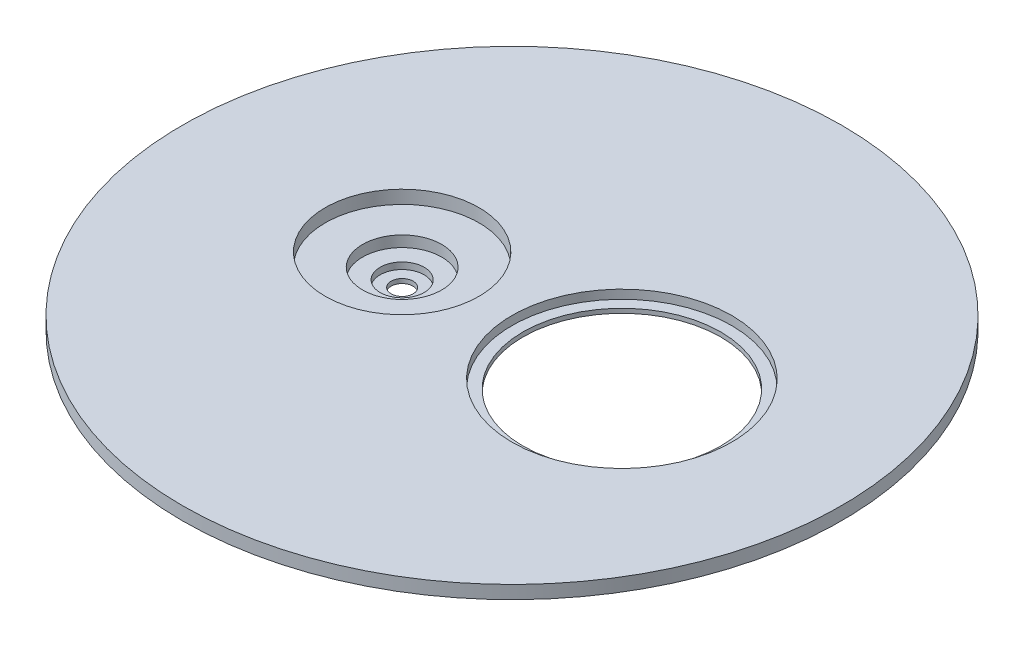
from build123d import *

# Parameters (mm, degrees)
SKETCH_1_R          = 75
EXTRUDE_1_DEPTH     = 3
SKETCH_2_R          = 17.5
SKETCH_2_R_2        = 25
CUT_EXTRUDE_1_DEPTH = 2
SKETCH_3_R          = 22.5
CUT_EXTRUDE_2_DEPTH = 2
SKETCH_12_R         = 17.5
CUT_EXTRUDE_7_DEPTH = 1
SKETCH_15_R         = 18.5
SKETCH_15_R_2       = 9
EXTRUDE_6_DEPTH     = 2.5
SKETCH_16_R         = 10
SKETCH_16_R_2       = 2.5
EXTRUDE_7_DEPTH     = 2.5
SKETCH_17_R         = 5
CUT_EXTRUDE_9_DEPTH = 1.5


with BuildPart() as part:
    # 草图1 → 凸台-拉伸1 (new body)
    with BuildSketch(Plane(origin=(0, 0, 0), x_dir=(1, 0, 0), z_dir=(0, 1, 0))):
        with Locations(Location((0, 0, 0), (0, 0, 270))):
            Circle(SKETCH_1_R)
    extrude(amount=EXTRUDE_1_DEPTH)

    # 草图2 → 切除-拉伸1 (cut)
    with BuildSketch(Plane(origin=(0, 3, 0), x_dir=(1, 0, 0), z_dir=(0, 1, 0))):
        with Locations(Location((-25, 0, 0), (0, 0, 270))):
            Circle(SKETCH_2_R)
        with Locations(Location((25, 0, 0), (0, 0, 270))):
            Circle(SKETCH_2_R_2)
    extrude(amount=-CUT_EXTRUDE_1_DEPTH, mode=Mode.SUBTRACT)

    # 草图3 → 切除-拉伸2 (cut)
    with BuildSketch(Plane.XZ):
        with Locations(Location((25, 0, 0), (0, 0, 270))):
            Circle(SKETCH_3_R)
    extrude(amount=-CUT_EXTRUDE_2_DEPTH, mode=Mode.SUBTRACT)

    # 草图12 → 切除-拉伸7 (cut)
    with BuildSketch(Plane(origin=(0, 1, 0), x_dir=(1, 0, 0), z_dir=(0, 1, 0))):
        with Locations(Location((-25, 0, 0), (0, 0, 270))):
            Circle(SKETCH_12_R)
    extrude(amount=-CUT_EXTRUDE_7_DEPTH, mode=Mode.SUBTRACT)

    # 草图15 → 凸台-拉伸6 (add)
    with BuildSketch(Plane.XZ):
        with Locations(Location((-25, 0, 0), (0, 0, 90))):
            Circle(SKETCH_15_R)
        with Locations(Location((-25, 0, 0), (0, 0, 270))):
            Circle(SKETCH_15_R_2, mode=Mode.SUBTRACT)
    extrude(amount=EXTRUDE_6_DEPTH)

    # 草图16 → 凸台-拉伸7 (add)
    with BuildSketch(Plane.XZ.offset(2.5)):
        with Locations(Location((-25, 0, 0), (0, 0, 270))):
            Circle(SKETCH_16_R)
        with Locations(Location((-25, 0, 0), (0, 0, 270))):
            Circle(SKETCH_16_R_2, mode=Mode.SUBTRACT)
    extrude(amount=EXTRUDE_7_DEPTH)

    # 草图17 → 切除-拉伸9 (cut)
    with BuildSketch(Plane(origin=(0, -2.5, 0), x_dir=(1, 0, 0), z_dir=(0, 1, 0))):
        with Locations(Location((-25, 0, 0), (0, 0, 270))):
            Circle(SKETCH_17_R)
    extrude(amount=-CUT_EXTRUDE_9_DEPTH, mode=Mode.SUBTRACT)


solid = part.part
